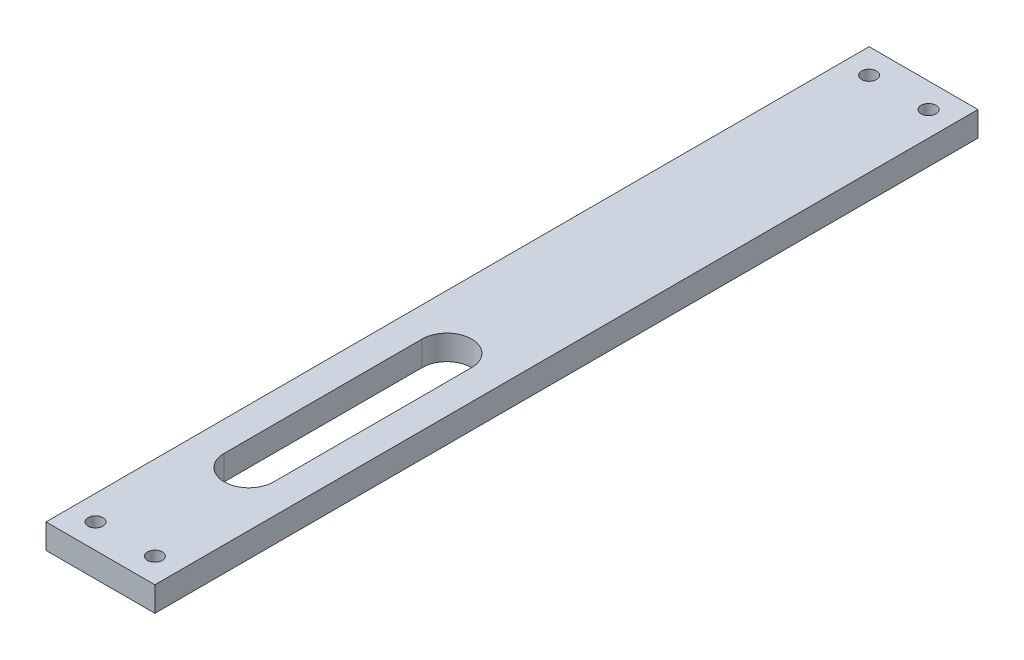
from build123d import *

# Parameters (mm, degrees)
SKETCH1_W           = 22
SKETCH1_H           = 166.3
SKETCH1_R           = 1.5
BOSS_EXTRUDE1_DEPTH = 5
CUT_EXTRUDE1_DEPTH  = 5


with BuildPart() as part:
    # Sketch1 → Boss-Extrude1 (new body)
    with BuildSketch(Plane(origin=(0, 0, 0), x_dir=(1, 0, 0), z_dir=(0, 1, 0))):
        with Locations((11, 83.15)):
            Rectangle(SKETCH1_W, SKETCH1_H)
        with Locations(Location((5, 161.3, 0), (0, 0, 270))):
            Circle(SKETCH1_R, mode=Mode.SUBTRACT)
        with Locations(Location((17, 161.3, 0), (0, 0, 270))):
            Circle(SKETCH1_R, mode=Mode.SUBTRACT)
        with Locations(Location((17, 5, 0), (0, 0, 270))):
            Circle(SKETCH1_R, mode=Mode.SUBTRACT)
        with Locations(Location((5, 5, 0), (0, 0, 270))):
            Circle(SKETCH1_R, mode=Mode.SUBTRACT)
    extrude(amount=BOSS_EXTRUDE1_DEPTH)

    # Sketch2 → Cut-Extrude1 (cut)
    with BuildSketch(Plane(origin=(0, 0, 0), x_dir=(-1, 0, 0), z_dir=(0, -1, 0))):
        with BuildLine():
            Line((-16, 30), (-16, 70))
            ThreePointArc((-16, 70), (-11, 75), (-6, 70))
            Line((-6, 70), (-6, 30))
            ThreePointArc((-6, 30), (-11, 25), (-16, 30))
        make_face()
    extrude(amount=-CUT_EXTRUDE1_DEPTH, mode=Mode.SUBTRACT)


solid = part.part
